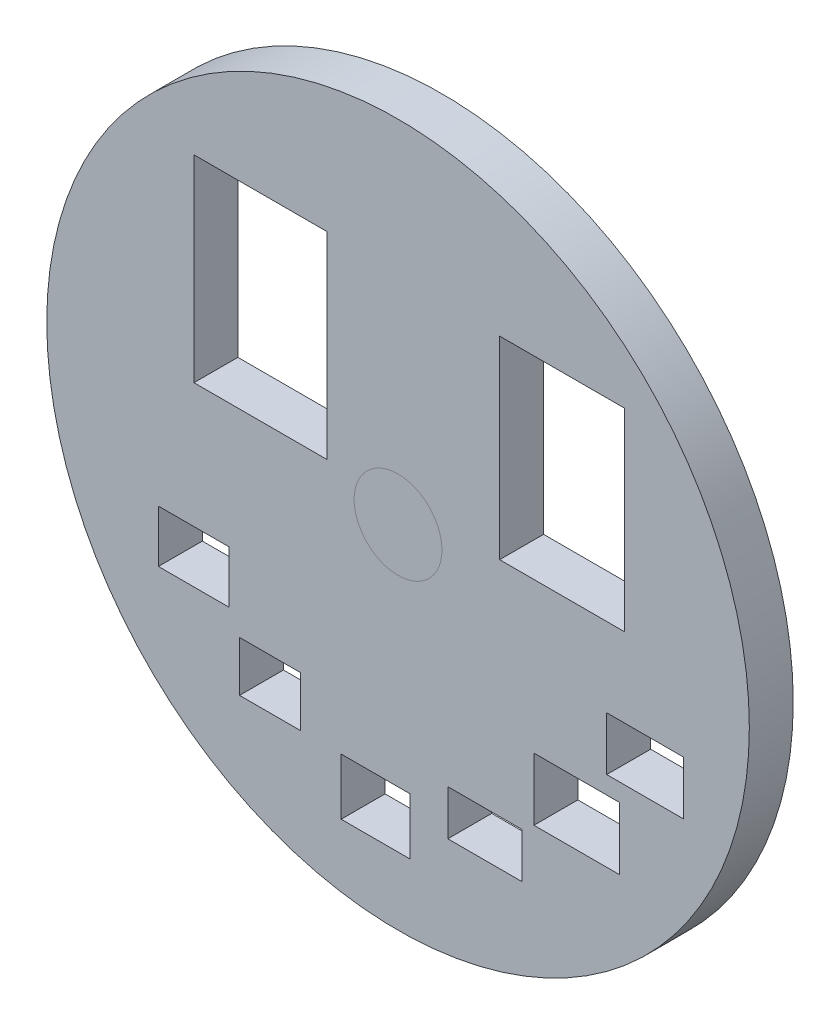
from build123d import *

# Parameters (mm, degrees)
SKETCH1_R           = 50.8
BOSS_EXTRUDE1_DEPTH = 6.35
SKETCH2_W           = 19.230854478
SKETCH2_H           = 28.543909792
SKETCH2_W_2         = 18.081841161
SKETCH2_H_2         = 27.999640326
SKETCH2_W_3         = 10.22017109
SKETCH2_H_3         = 7.559298144
SKETCH2_W_4         = 8.829260232
SKETCH2_H_4         = 7.256926218
SKETCH2_W_5         = 9.97827355
SKETCH2_H_5         = 8.164041996
SKETCH2_W_6         = 10.703966172
SKETCH2_H_6         = 6.531233596
SKETCH2_W_7         = 12.336774571
SKETCH2_H_7         = 9.04092058
SKETCH2_W_8         = 11.127286868
SKETCH2_H_8         = 7.7407213
CUT_EXTRUDE1_DEPTH  = 73.122135992


with BuildPart() as part:
    # Sketch1 → Boss-Extrude1 (new body)
    with BuildSketch(Plane.XY):
        Circle(SKETCH1_R)
    extrude(amount=BOSS_EXTRUDE1_DEPTH)

    # Sketch2 → Cut-Extrude1 (cut, through all)
    with BuildSketch(Plane.XY.offset(6.35)):
        with Locations((-19.896072715, 17.295674154)):
            Rectangle(SKETCH2_W, SKETCH2_H)
        with Locations((23.736196173, 16.963065035)):
            Rectangle(SKETCH2_W_2, SKETCH2_H_2)
        with Locations((-29.541737147, -18.77729659)):
            Rectangle(SKETCH2_W_3, SKETCH2_H_3)
        with Locations((-18.505161857, -29.209128029)):
            Rectangle(SKETCH2_W_4, SKETCH2_H_4)
        with Locations((-3.235379606, -36.919612136)):
            Rectangle(SKETCH2_W_5, SKETCH2_H_5)
        with Locations((12.548434919, -32.474744827)):
            Rectangle(SKETCH2_W_6, SKETCH2_H_6)
        with Locations((25.822562461, -23.29775688)):
            Rectangle(SKETCH2_W_7, SKETCH2_H_7)
        with Locations((35.740361625, -12.336774571)):
            Rectangle(SKETCH2_W_8, SKETCH2_H_8)
    extrude(amount=-CUT_EXTRUDE1_DEPTH, mode=Mode.SUBTRACT)


solid = part.part
